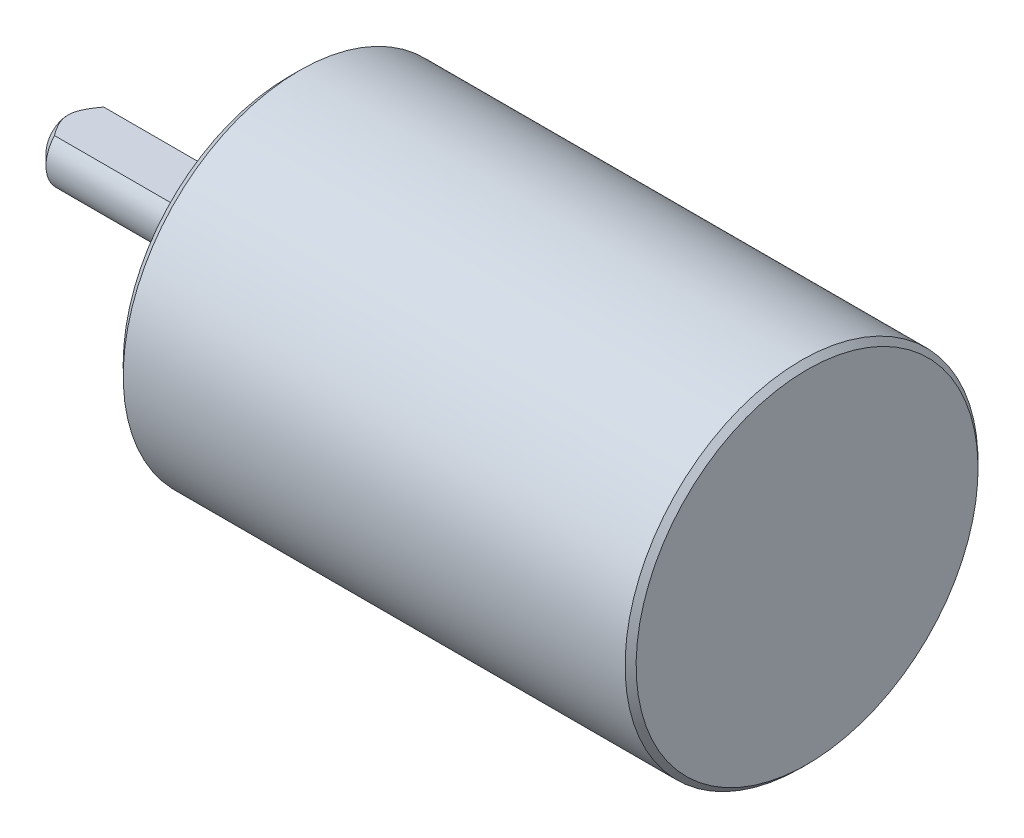
from build123d import *

# Parameters (mm, degrees)
TROU_TARAUD_M3X0_51_D     = 2.5
TROU_TARAUD_M3X0_51_DEPTH = 4
TROU_TARAUD_M3X0_51_TIP   = 0.751075774
CHANFREIN1_SIZE           = 0.5
CHANFREIN2_SIZE           = 1
CONG_1_R                  = 1
CHANFREIN3_SIZE           = 1
ESQUISSE4_W               = 15
ESQUISSE4_H               = 6
ENL_V_MAT_EXTRU_1_DEPTH   = 1


with BuildPart() as part:
    # Esquisse1 → Révolution1 (revolve)
    with BuildSketch(Plane.XY):
        Polygon((0, 0), (0, 3), (17, 3), (17, 10), (20, 10), (20, 16), (67, 16), (67, 0), align=None)
    revolve(axis=Axis((67, 0, 0), (-1, 0, 0)))

    # Trou taraudé M3x0.51
    with Locations(Plane.ZY.offset(-20)):
        with Locations((-13, 0), (0, 13), (13, 0), (0, -13)):
            Hole(TROU_TARAUD_M3X0_51_D / 2, depth=TROU_TARAUD_M3X0_51_DEPTH)
            with Locations((0, 0, -(TROU_TARAUD_M3X0_51_DEPTH + TROU_TARAUD_M3X0_51_TIP / 2))):  # 118° drill point
                Cone(0, TROU_TARAUD_M3X0_51_D / 2, TROU_TARAUD_M3X0_51_TIP, mode=Mode.SUBTRACT)

    # Chanfrein1
    chanfrein1_edges = [part.edges().sort_by_distance(p)[0] for p in [
        (67, -16, 0),
    ]]
    chamfer(chanfrein1_edges, length=CHANFREIN1_SIZE)

    # Chanfrein2
    chanfrein2_edges = [part.edges().sort_by_distance(p)[0] for p in [
        (20, -16, 0),
    ]]
    chamfer(chanfrein2_edges, length=CHANFREIN2_SIZE)

    # Congé1
    cong_1_edges = [part.edges().sort_by_distance(p)[0] for p in [
        (17, -10, 0),
    ]]
    fillet(cong_1_edges, radius=CONG_1_R)

    # Chanfrein3
    chanfrein3_edges = [part.edges().sort_by_distance(p)[0] for p in [
        (0, -3, 0),
    ]]
    chamfer(chanfrein3_edges, length=CHANFREIN3_SIZE)

    # Esquisse4 → Enlèv. mat.-Extru.1 (cut)
    with BuildSketch(Plane(origin=(0, 3, 0), x_dir=(1, 0, 0), z_dir=(0, 1, 0))):
        with Locations((7.5, 0)):
            Rectangle(ESQUISSE4_W, ESQUISSE4_H)
    extrude(amount=-ENL_V_MAT_EXTRU_1_DEPTH, mode=Mode.SUBTRACT)


solid = part.part
